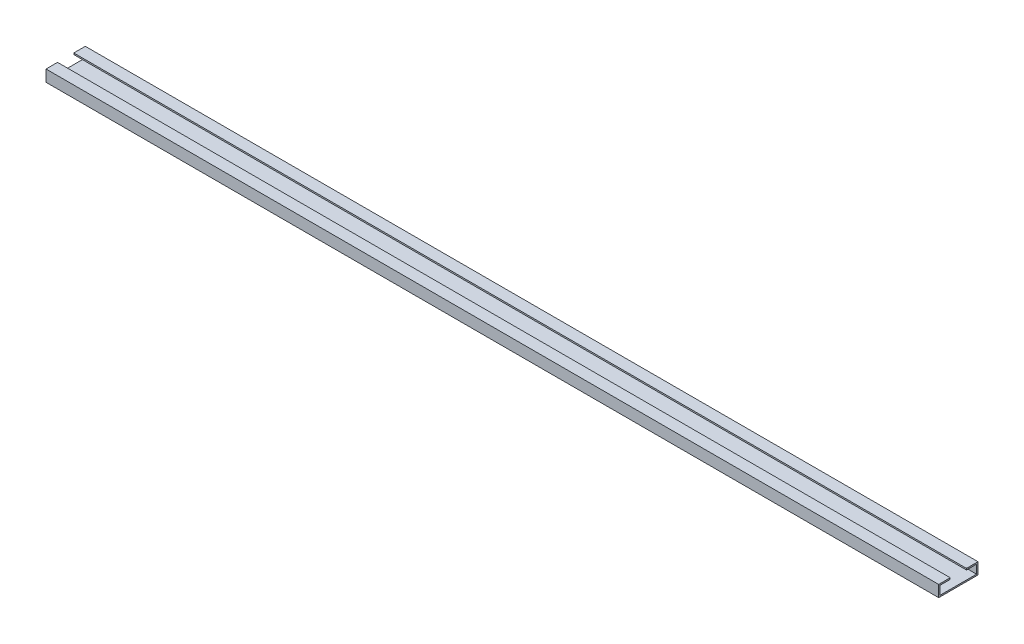
from build123d import *

# Parameters (mm, degrees)
Y_KSEKLIK_EKSTR_ZYON1_DEPTH = 310


with BuildPart() as part:
    # Çizim1 → Yükseklik-Ekstrüzyon1 (new body)
    with BuildSketch(Plane(origin=(0, 0, 0), x_dir=(0, -1, 0), z_dir=(-1, 0, 0))):
        Polygon((0, 0), (-4, 0), (-4, -4), (-3.5, -4), (-3.5, -0.5), (-0.5, -0.5), (-0.5, -13.15), (-3.5, -13.15), (-3.5, -9.65), (-4, -9.65), (-4, -13.65), (0, -13.65), align=None)
    extrude(amount=-Y_KSEKLIK_EKSTR_ZYON1_DEPTH)


solid = part.part
